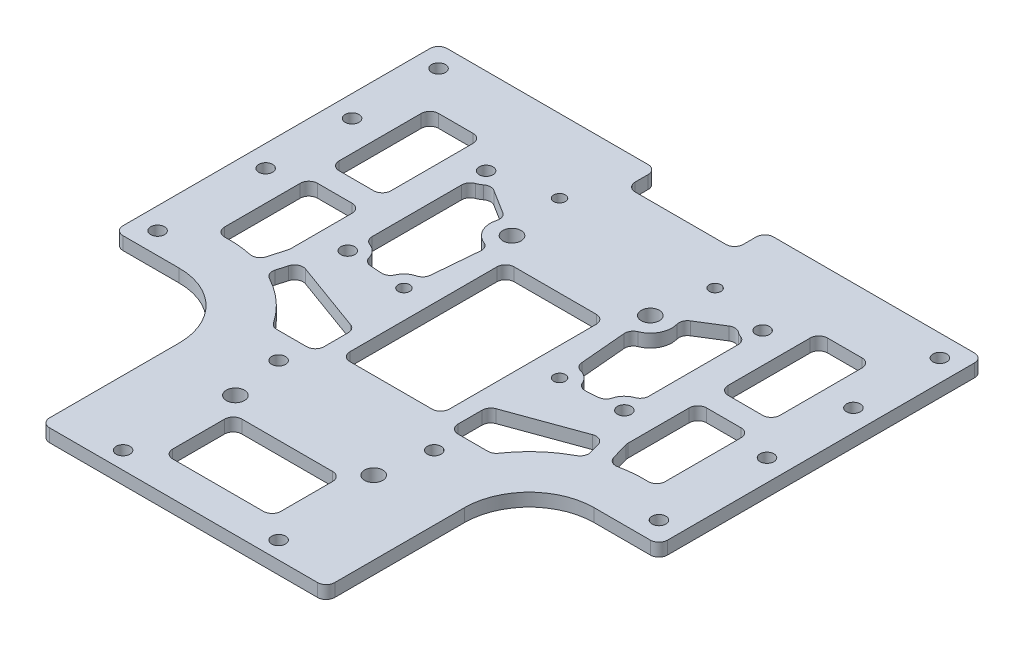
from build123d import *

# Parameters (mm, degrees)
SKETCH_1_W             = 126
SKETCH_1_H             = 110
EXTRUDE_1_DEPTH        = 3
SKETCH_2_W             = 25
SKETCH_2_H             = 14
CUT_EXTRUDE_1_DEPTH    = 10
SKETCH_3_R             = 2.1
CUT_EXTRUDE_2_DEPTH    = 84.683929162
SKETCH_4_W             = 60
SKETCH_4_H             = 70
CUT_EXTRUDE_3_DEPTH    = 84.683929162
SKETCH_5_W             = 23
SKETCH_5_H             = 38
CUT_EXTRUDE_4_DEPTH    = 84.683929162
FILLET_1_R             = 2
SKETCH_6_R             = 1.6
CUT_EXTRUDE_5_DEPTH    = 84.683929162
FILLET_2_R             = 15
SKETCH_7_R             = 1.6
CUT_EXTRUDE_A_DEPTH    = 84.683929162
SKETCH_8_R             = 1.35
CUT_EXTRUDE_C_DEPTH    = 84.683929162
SKETCH_11_W            = 66
SKETCH_11_H            = 12
EXTRUDE_3_DEPTH        = 3
SKETCH_12_R            = 1.6
CUT_EXTRUDE_6_DEPTH    = 93.016302903
SKETCH_14_W            = 25
SKETCH_14_H            = 16
CUT_EXTRUDE_8_DEPTH    = 93.016302903
FILLET_3_R             = 2
SKETCH_13_W            = 12
SKETCH_13_H            = 23
CUT_EXTRUDE_7_DEPTH    = 10
FILLET_4_R             = 2
FILLET_4_OF_MIRROR_1_R = 2


with BuildPart() as part:
    # 草图1 → 凸台-拉伸1 (new body)
    with BuildSketch(Plane(origin=(0, 0, 0), x_dir=(1, 0, 0), z_dir=(0, 1, 0))):
        Rectangle(SKETCH_1_W, SKETCH_1_H)
    extrude(amount=EXTRUDE_1_DEPTH)

    # 草图2 → 切除-拉伸1 (cut)
    with BuildSketch(Plane(origin=(0, 3, 0), x_dir=(1, 0, 0), z_dir=(0, 1, 0))):
        with Locations((0, 55)):
            Rectangle(SKETCH_2_W, SKETCH_2_H)
    extrude(amount=-CUT_EXTRUDE_1_DEPTH, mode=Mode.SUBTRACT)

    # 草图3 → 切除-拉伸2 (cut, through all)
    with BuildSketch(Plane(origin=(0, 3, 0), x_dir=(1, 0, 0), z_dir=(0, 1, 0))):
        with Locations(Location((-16, 25, 0), (0, 0, 270))):
            Circle(SKETCH_3_R)
        with Locations(Location((-16, -39, 0), (0, 0, 270))):
            Circle(SKETCH_3_R)
        with Locations(Location((16, -39, 0), (0, 0, 90))):
            Circle(SKETCH_3_R)
        with Locations(Location((16, 25, 0), (0, 0, 90))):
            Circle(SKETCH_3_R)
    extrude(amount=-CUT_EXTRUDE_2_DEPTH, mode=Mode.SUBTRACT)

    # 草图4 → 切除-拉伸3 (cut, through all)
    with BuildSketch(Plane(origin=(0, 3, 0), x_dir=(1, 0, 0), z_dir=(0, 1, 0))):
        with Locations((-63, -55)):
            Rectangle(SKETCH_4_W, SKETCH_4_H)
        with Locations((63, -55)):
            Rectangle(SKETCH_4_W, SKETCH_4_H)
    extrude(amount=-CUT_EXTRUDE_3_DEPTH, mode=Mode.SUBTRACT)

    # 草图5 → 切除-拉伸4 (cut, through all)
    with BuildSketch(Plane(origin=(0, 3, 0), x_dir=(1, 0, 0), z_dir=(0, 1, 0))):
        Rectangle(SKETCH_5_W, SKETCH_5_H)
    extrude(amount=-CUT_EXTRUDE_4_DEPTH, mode=Mode.SUBTRACT)

    # 圆角1
    fillet_1_edges = [part.edges().sort_by_distance(p)[0] for p in [
        (-11.5, 1.5, 19),
        (-11.5, 1.5, -19),
        (11.5, 1.5, -19),
        (11.5, 1.5, 19),
    ]]
    fillet(fillet_1_edges, radius=FILLET_1_R)

    # 草图6 → 切除-拉伸5 (cut, through all)
    with BuildSketch(Plane(origin=(0, 3, 0), x_dir=(1, 0, 0), z_dir=(0, 1, 0))):
        with Locations(Location((-58, 50, 0), (0, 0, 270))):
            Circle(SKETCH_6_R)
        with Locations(Location((-58, 10, 0), (0, 0, 270))):
            Circle(SKETCH_6_R)
        with Locations(Location((-58, 30, 0), (0, 0, 270))):
            Circle(SKETCH_6_R)
        with Locations(Location((58, 30, 0), (0, 0, 90))):
            Circle(SKETCH_6_R)
        with Locations(Location((58, 10, 0), (0, 0, 90))):
            Circle(SKETCH_6_R)
        with Locations(Location((58, 50, 0), (0, 0, 90))):
            Circle(SKETCH_6_R)
        with Locations(Location((-58, -15, 0), (0, 0, 270))):
            Circle(SKETCH_6_R)
        with Locations(Location((58, -15, 0), (0, 0, 90))):
            Circle(SKETCH_6_R)
    extrude(amount=-CUT_EXTRUDE_5_DEPTH, mode=Mode.SUBTRACT)

    # 圆角2
    fillet_2_edges = [part.edges().sort_by_distance(p)[0] for p in [
        (-33, 1.5, 20),
        (33, 1.5, 20),
    ]]
    fillet(fillet_2_edges, radius=FILLET_2_R)

    # 草图7 → A板安装孔 (cut, through all)
    with BuildSketch(Plane(origin=(0, 3, 0), x_dir=(1, 0, 0), z_dir=(0, 1, 0))):
        with Locations(Location((32, 35, 0), (0, 0, 270))):
            Circle(SKETCH_7_R)
        with Locations(Location((32, 3, 0), (0, 0, 270))):
            Circle(SKETCH_7_R)
        with Locations(Location((-32, 3, 0), (0, 0, 90))):
            Circle(SKETCH_7_R)
        with Locations(Location((-32, 35, 0), (0, 0, 90))):
            Circle(SKETCH_7_R)
    extrude(amount=-CUT_EXTRUDE_A_DEPTH, mode=Mode.SUBTRACT)

    # 草图8 → C板安装孔 (cut, through all)
    with BuildSketch(Plane(origin=(0, 3, 0), x_dir=(1, 0, 0), z_dir=(0, 1, 0))):
        with Locations(Location((18, 38, 0), (0, 0, 270))):
            Circle(SKETCH_8_R)
        with Locations(Location((18, 2, 0), (0, 0, 270))):
            Circle(SKETCH_8_R)
        with Locations(Location((-18, 2, 0), (0, 0, 270))):
            Circle(SKETCH_8_R)
        with Locations(Location((-18, 38, 0), (0, 0, 270))):
            Circle(SKETCH_8_R)
    extrude(amount=-CUT_EXTRUDE_C_DEPTH, mode=Mode.SUBTRACT)

    # 草图11 → 凸台-拉伸3 (add)
    with BuildSketch(Plane(origin=(0, 0, 0), x_dir=(1, 0, 0), z_dir=(0, 1, 0))):
        with Locations((0, -61)):
            Rectangle(SKETCH_11_W, SKETCH_11_H)
    extrude(amount=EXTRUDE_3_DEPTH)

    # 草图12 → 切除-拉伸6 (cut, through all)
    with BuildSketch(Plane(origin=(0, 3, 0), x_dir=(1, 0, 0), z_dir=(0, 1, 0))):
        with Locations(Location((-18, -27, 0), (0, 0, 270))):
            Circle(SKETCH_12_R)
        with Locations(Location((18, -27, 0), (0, 0, 270))):
            Circle(SKETCH_12_R)
        with Locations(Location((-18, -63, 0), (0, 0, 270))):
            Circle(SKETCH_12_R)
        with Locations(Location((18, -63, 0), (0, 0, 270))):
            Circle(SKETCH_12_R)
    extrude(amount=-CUT_EXTRUDE_6_DEPTH, mode=Mode.SUBTRACT)

    # 草图14 → 切除-拉伸8 (cut, through all)
    with BuildSketch(Plane(origin=(0, 3, 0), x_dir=(1, 0, 0), z_dir=(0, 1, 0))):
        with Locations((0, -51)):
            Rectangle(SKETCH_14_W, SKETCH_14_H)
    extrude(amount=-CUT_EXTRUDE_8_DEPTH, mode=Mode.SUBTRACT)

    # 圆角3
    fillet_3_edges = [part.edges().sort_by_distance(p)[0] for p in [
        (-12.5, 1.5, -55),
        (-12.5, 1.5, -48),
        (12.5, 1.5, -55),
        (12.5, 1.5, -48),
        (-33, 1.5, 67),
        (33, 1.5, 67),
        (-12.5, 1.5, 59),
        (-12.5, 1.5, 43),
        (12.5, 1.5, 43),
        (12.5, 1.5, 59),
        (-63, 1.5, 20),
        (63, 1.5, 20),
        (-63, 1.5, -55),
        (63, 1.5, -55),
    ]]
    fillet(fillet_3_edges, radius=FILLET_3_R)

    # 草图13 → 切除-拉伸7 (cut)
    with BuildSketch(Plane(origin=(0, 3, 0), x_dir=(1, 0, 0), z_dir=(0, 1, 0))):
        with BuildLine():
            Line((-20.23999152, 27.6499947), (-28.608006784, 32.88000424))
            ThreePointArc((-28.608006784, 32.88000424), (-30.06092587, 31.501430075), (-32, 31))
            Line((-32, 31), (-32, 7))
            ThreePointArc((-32, 7), (-29.072547797, 5.725806963), (-28.010165201, 2.7150118))
            Line((-28.010165201, 2.7150118), (-21.989834799, 2.2849882))
            ThreePointArc((-21.989834799, 2.2849882), (-20.596322526, 5.042878463), (-17.653481535, 5.984962353))
            Line((-17.653481535, 5.984962353), (-16.433148082, 20.018797059))
            ThreePointArc((-16.433148082, 20.018797059), (-20.474187389, 22.768039605), (-20.23999152, 27.6499947))
        make_face()
        with Locations((-45, 29.5)):
            Rectangle(SKETCH_13_W, SKETCH_13_H)
        with BuildLine():
            Line((-39, -3.446699495), (-39, 13))
            Line((-39, 13), (-51, 13))
            Line((-51, 13), (-51, -8.670358909))
            ThreePointArc((-51, -8.670358909), (-45.824117513, -8.589480592), (-40.731261871, -9.516369058))
            Line((-40.731261871, -9.516369058), (-39, -3.446699495))
        make_face()
        with BuildLine():
            Line((-15.5, -12), (-35.231678572, -4.818256328))
            Line((-35.231678572, -4.818256328), (-36.967958309, -10.90551814))
            ThreePointArc((-36.967958309, -10.90551814), (-30.490742563, -15.108396143), (-25.5, -21))
            Line((-25.5, -21), (-15.5, -21))
            Line((-15.5, -21), (-15.5, -12))
        make_face()
    cut_extrude_7 = extrude(amount=-CUT_EXTRUDE_7_DEPTH, mode=Mode.SUBTRACT)

    # 圆角4
    fillet_4_edges = [part.edges().sort_by_distance(p)[0] for p in [
        (-20.23999152, 1.5, -27.6499947),
        (-16.433148082, 1.5, -20.018797059),
        (-17.653481535, 1.5, -5.984962353),
        (-21.989834799, 1.5, -2.2849882),
        (-28.010165201, 1.5, -2.7150118),
        (-32, 1.5, -7),
        (-32, 1.5, -31),
        (-28.608006784, 1.5, -32.88000424),
        (-40.731261871, 1.5, 9.516369058),
        (-51, 1.5, 8.670358909),
        (-51, 1.5, -13),
        (-39, 1.5, -13),
        (-39, 1.5, 3.446699495),
        (-25.5, 1.5, 21),
        (-36.967958309, 1.5, 10.90551814),
        (-35.231678572, 1.5, 4.818256328),
        (-15.5, 1.5, 12),
        (-15.5, 1.5, 21),
        (-51, 1.5, -41),
        (-39, 1.5, -41),
        (-39, 1.5, -18),
        (-51, 1.5, -18),
    ]]
    fillet(fillet_4_edges, radius=FILLET_4_R)

    # 镜向1: 切除-拉伸7 across plane
    add(cut_extrude_7.mirror(Plane(origin=(0, 0, 0), x_dir=(0, 0, 1), z_dir=(1, 0, 0))), mode=Mode.SUBTRACT)

    # 圆角4 of 镜向1
    fillet_4_of_mirror_1_edges = [part.edges().sort_by_distance(p)[0] for p in [
        (20.23999152, 1.5, -27.6499947),
        (16.433148082, 1.5, -20.018797059),
        (17.653481535, 1.5, -5.984962353),
        (21.989834799, 1.5, -2.2849882),
        (28.010165201, 1.5, -2.7150118),
        (32, 1.5, -7),
        (32, 1.5, -31),
        (28.608006784, 1.5, -32.88000424),
        (40.731261871, 1.5, 9.516369058),
        (51, 1.5, 8.670358909),
        (51, 1.5, -13),
        (39, 1.5, -13),
        (39, 1.5, 3.446699495),
        (25.5, 1.5, 21),
        (36.967958309, 1.5, 10.90551814),
        (35.231678572, 1.5, 4.818256328),
        (15.5, 1.5, 12),
        (15.5, 1.5, 21),
        (51, 1.5, -41),
        (39, 1.5, -41),
        (39, 1.5, -18),
        (51, 1.5, -18),
    ]]
    fillet(fillet_4_of_mirror_1_edges, radius=FILLET_4_OF_MIRROR_1_R)


solid = part.part
